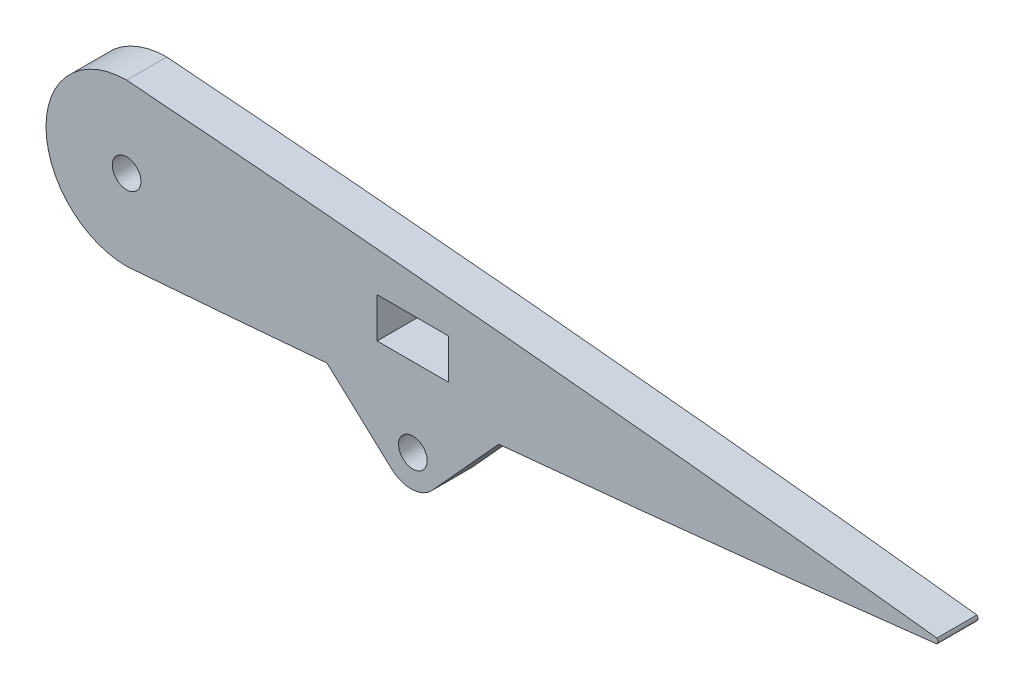
from build123d import *

# Parameters (mm, degrees)
SKETCH_1_R      = 1
SKETCH_1_W      = 5
SKETCH_1_H      = 2.8
EXTRUDE_1_DEPTH = 1.4


with BuildPart() as part:
    # Эскиз1 → Бобышка-Вытянуть1 (new, symmetric)
    with BuildSketch(Plane.XY):
        with BuildLine():
            ThreePointArc((223.382624747, 5.634990628), (219.398084745, 3.984540168), (217.747634119, 2.35e-07))
            ThreePointArc((217.747634119, 2.35e-07), (219.398084579, -3.984540002), (223.382624747, -5.634990628))
            add(Edge.make_bspline(
                [(223.382624746, -5.634990613), (224.328656864, -5.56201019), (226.923894547, -5.35916654), (231.150377303, -5.017351086), (234.870714804, -4.704112055), (236.94221324, -4.525459463), (237.382624747, -4.487285848)],
                knots=[0.670161589, 0.670161589, 0.670161589, 0.670161589, 0.686667237, 0.715444849, 0.743923546, 0.751613474, 0.751613474, 0.751613474, 0.751613474], degree=3))
            Line((237.382624747, -4.487285848), (241.902085906, -8.639702096))
            ThreePointArc((241.902085906, -8.639702096), (243.345073916, -9.164930306), (244.73509722, -8.51230922))
            Line((244.73509722, -8.51230922), (249.382624747, -3.400128388))
            add(Edge.make_bspline(
                [(249.382624747, -3.400128388), (251.158571989, -3.232274224), (254.371192488, -2.923000161), (258.952644662, -2.467188138), (263.047743378, -2.047856604), (266.898988862, -1.642607304), (270.455833183, -1.258590905), (273.651166984, -0.905304265), (276.385426802, -0.596436482), (278.45259621, -0.358958361), (279.592043704, -0.226075898), (280, -0.1785)],
                knots=[0.821480844, 0.821480844, 0.821480844, 0.821480844, 0.852512115, 0.877624446, 0.901571134, 0.924121062, 0.944988816, 0.963803939, 0.980044339, 0.992855276, 1, 1, 1, 1], degree=3))
            ThreePointArc((280, -0.1785), (280.073937121, 0), (280, 0.1785))
            add(Edge.make_bspline(
                [(280, 0.1785), (279.592043704, 0.226075898), (278.45259621, 0.358958361), (276.385426802, 0.596436482), (273.651166984, 0.905304265), (270.455833183, 1.258590905), (266.898988862, 1.642607304), (263.047743378, 2.047856604), (258.952644662, 2.467188138), (253.116111921, 3.047869044), (247.071089236, 3.62220531), (240.854179313, 4.184912649), (236.038226964, 4.605811749), (231.150377303, 5.017351103), (226.923894547, 5.359166556), (224.328656864, 5.562010205), (223.382624747, 5.634990628)],
                knots=[0, 0, 0, 0, 0.007144724, 0.019955661, 0.036196061, 0.055011184, 0.075878938, 0.098428866, 0.122375554, 0.147487885, 0.200459747, 0.22800517, 0.256076454, 0.284555151, 0.313332763, 0.329838411, 0.329838411, 0.329838411, 0.329838411], degree=3))
        make_face()
        with Locations((243.382624747, -6.903125596)):
            Circle(SKETCH_1_R, mode=Mode.SUBTRACT)
        with Locations((223.382624747, 0)):
            Circle(SKETCH_1_R, mode=Mode.SUBTRACT)
        with Locations((243.382624747, 0)):
            Rectangle(SKETCH_1_W, SKETCH_1_H, mode=Mode.SUBTRACT)
    extrude(amount=EXTRUDE_1_DEPTH, both=True)


solid = part.part
